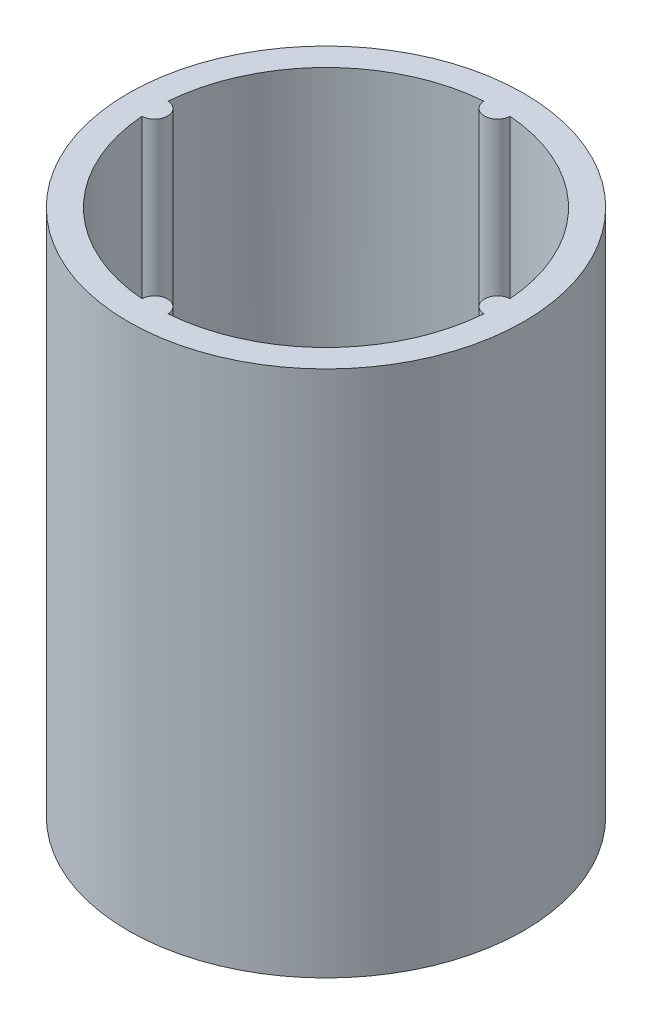
from build123d import *

# Parameters (mm, degrees)
SKETCH2_R           = 30
BOSS_EXTRUDE1_DEPTH = 80
SKETCH3_R           = 26.016919331
CUT_EXTRUDE4_DEPTH  = 75
SKETCH5_W           = 40
SKETCH5_H           = 10
CUT_EXTRUDE6_DEPTH  = 91.553851381
SKETCH6_R           = 1.983080669
BOSS_EXTRUDE2_DEPTH = 63


with BuildPart() as part:
    # Sketch2 → Boss-Extrude1 (new body)
    with BuildSketch(Plane(origin=(0, 0, 0), x_dir=(1, 0, 0), z_dir=(0, 1, 0))):
        with Locations(Location((0, 0, 0), (0, 0, 270))):
            Circle(SKETCH2_R)
    extrude(amount=BOSS_EXTRUDE1_DEPTH)

    # Sketch3 → Cut-Extrude4 (cut)
    with BuildSketch(Plane(origin=(0, 80, 0), x_dir=(1, 0, 0), z_dir=(0, 1, 0))):
        with Locations(Location((0, 0, 0), (0, 0, 270))):
            Circle(SKETCH3_R)
    extrude(amount=-CUT_EXTRUDE4_DEPTH, mode=Mode.SUBTRACT)

    # Sketch5 → Cut-Extrude6 (cut, through all)
    with BuildSketch(Plane(origin=(0, 0, 0), x_dir=(0, 0, -1), z_dir=(1, 0, 0))):
        with Locations((0, 6.124342534)):
            Rectangle(SKETCH5_W, SKETCH5_H)
    extrude(amount=-CUT_EXTRUDE6_DEPTH, mode=Mode.SUBTRACT)

    # Sketch6 → Boss-Extrude2 (add)
    with BuildSketch(Plane(origin=(0, 80, 0), x_dir=(1, 0, 0), z_dir=(0, 1, 0))):
        with Locations((26.016919331, 0)):
            Circle(SKETCH6_R)
        with Locations((-26.016919331, 0)):
            Circle(SKETCH6_R)
        with Locations((0, -26.016919331)):
            Circle(SKETCH6_R)
        with Locations((0, 26.016919331)):
            Circle(SKETCH6_R)
    extrude(amount=-BOSS_EXTRUDE2_DEPTH)


solid = part.part
